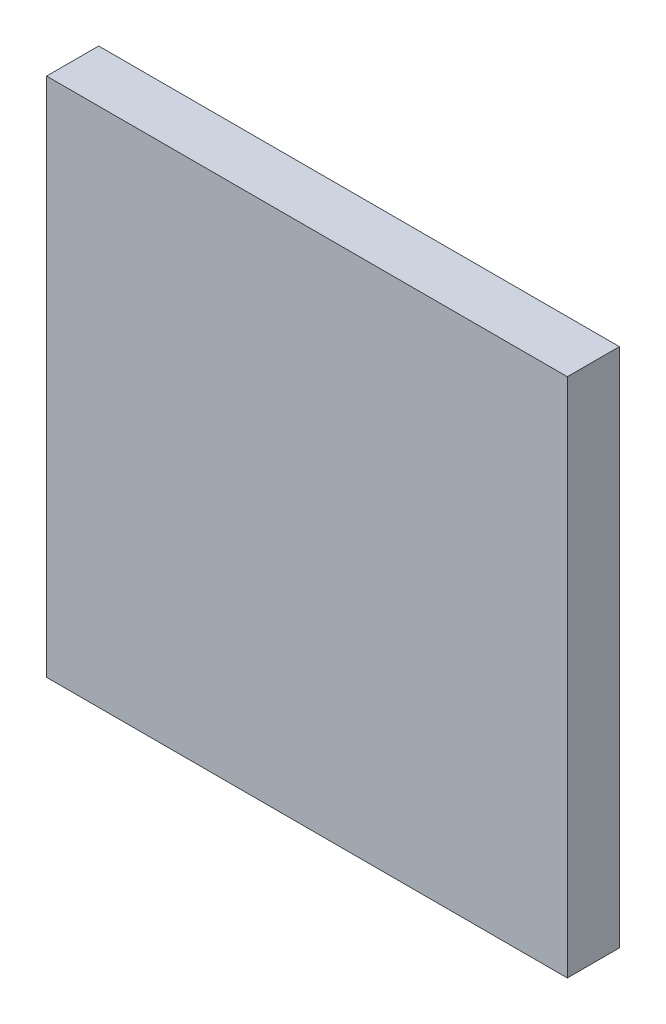
from build123d import *

# Parameters (mm, degrees)
SKETCH_1_W      = 40
SKETCH_1_H      = 40
EXTRUDE_1_DEPTH = 4


with BuildPart() as part:
    # Эскиз1 → Бобышка-Вытянуть1 (new body)
    with BuildSketch(Plane.XY):
        Rectangle(SKETCH_1_W, SKETCH_1_H)
    extrude(amount=EXTRUDE_1_DEPTH)


solid = part.part
